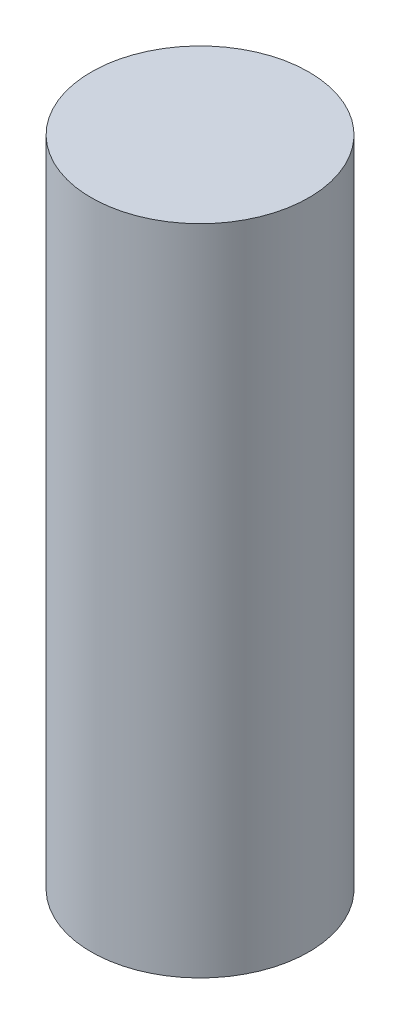
from build123d import *

# Parameters (mm, degrees)
SKETCH1_R           = 1.5875
BOSS_EXTRUDE1_DEPTH = 9.525


with BuildPart() as part:
    # Sketch1 → Boss-Extrude1 (new body)
    with BuildSketch(Plane(origin=(0, 0, 0), x_dir=(1, 0, 0), z_dir=(0, 1, 0))):
        with Locations(Location((0, 0, 0), (0, 0, 90))):
            Circle(SKETCH1_R)
    extrude(amount=BOSS_EXTRUDE1_DEPTH)


solid = part.part
